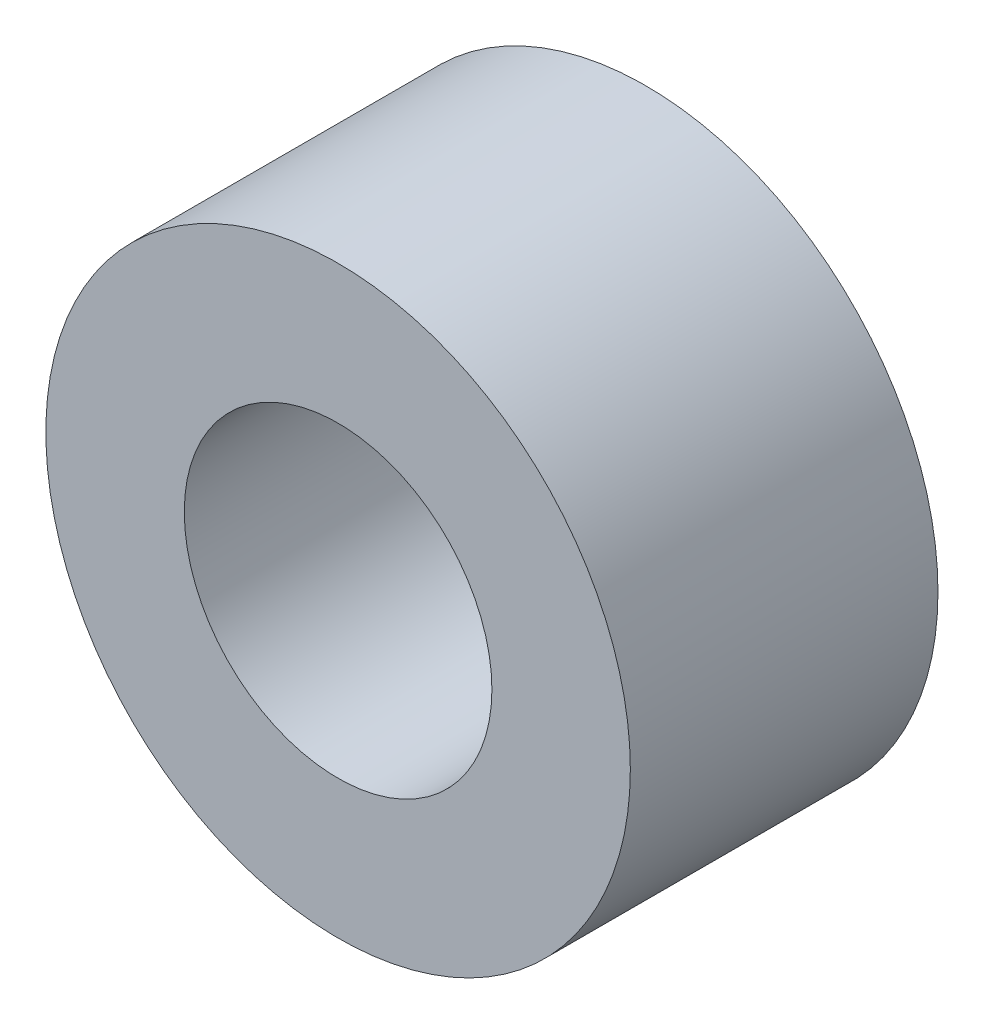
from build123d import *

# Parameters (mm, degrees)
SKETCH_1_R          = 4.75
SKETCH_1_R_2        = 2.5
EXTRUDE_1_DEPTH     = 5
SKETCH_2_R          = 2.5
CUT_EXTRUDE_1_DEPTH = 5


with BuildPart() as part:
    # 草图1 → 凸台-拉伸1 (new body)
    # profile 1 of 2: a face of its own
    with BuildSketch(Plane.XY):
        Circle(SKETCH_1_R)
        Circle(SKETCH_1_R_2, mode=Mode.SUBTRACT)
    # profile 2 of 2: a face of its own
    with BuildSketch(Plane.XY):
        Circle(SKETCH_1_R_2)
    extrude(amount=EXTRUDE_1_DEPTH)

    # 草图2 → 切除-拉伸1 (cut)
    with BuildSketch(Plane.XY.offset(5)):
        Circle(SKETCH_2_R)
    extrude(amount=-CUT_EXTRUDE_1_DEPTH, mode=Mode.SUBTRACT)


solid = part.part
